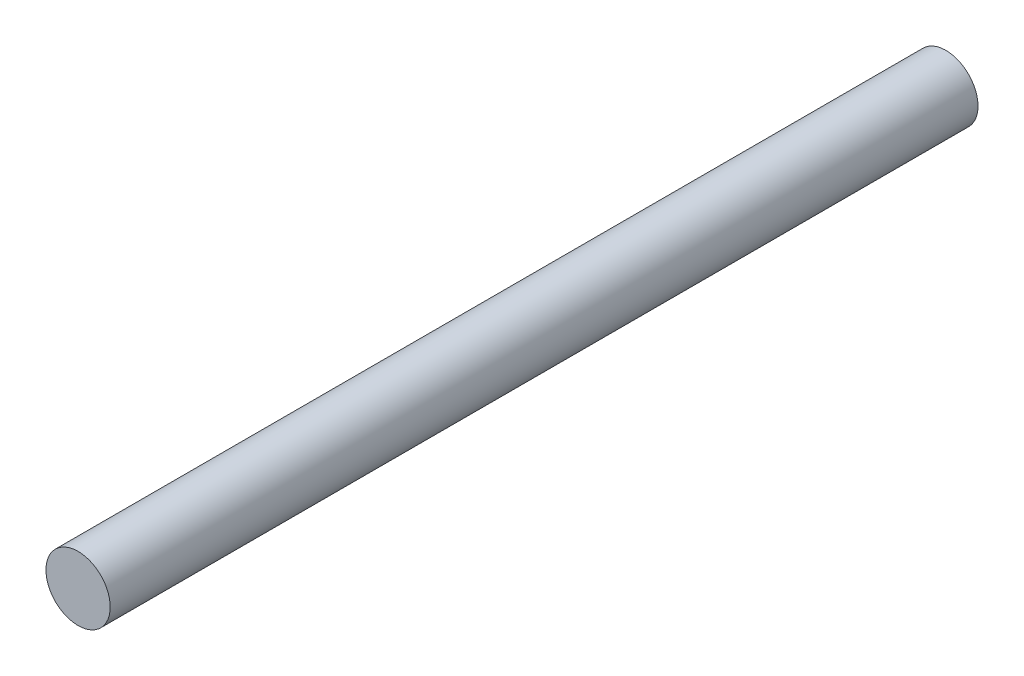
from build123d import *

# Parameters (mm, degrees)
SKETCH1_R           = 5
BOSS_EXTRUDE1_DEPTH = 67.5


with BuildPart() as part:
    # Sketch1 → Boss-Extrude1 (new, symmetric)
    with BuildSketch(Plane.XY):
        Circle(SKETCH1_R)
    extrude(amount=BOSS_EXTRUDE1_DEPTH, both=True)


solid = part.part
